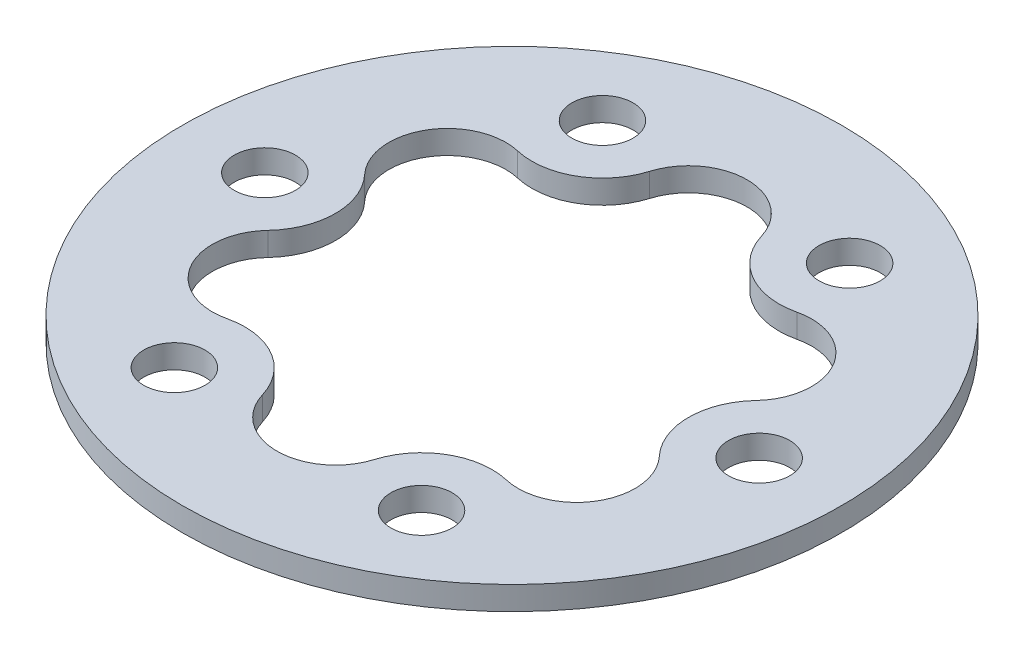
from build123d import *

# Parameters (mm, degrees)
SKETCH_1_R               = 28
SKETCH_1_R_2             = 2.6
EXTRUDE_1_DEPTH          = 2
CUT_EXTRUDE_2_DEPTH      = 40.648455203
CUT_EXTRUDE_2_DEPTH_BACK = 40.648455203


with BuildPart() as part:
    # 草图1 → 凸台-拉伸1 (new body)
    with BuildSketch(Plane(origin=(0, 0, 0), x_dir=(1, 0, 0), z_dir=(0, 1, 0))):
        with Locations(Location((0, 0, 0), (0, 0, 270))):
            Circle(SKETCH_1_R)
        with Locations(Location((10.5, 18.186533479, 0), (0, 0, 270))):
            Circle(SKETCH_1_R_2, mode=Mode.SUBTRACT)
        with Locations(Location((21, 0, 0), (0, 0, 270))):
            Circle(SKETCH_1_R_2, mode=Mode.SUBTRACT)
        with Locations(Location((10.5, -18.186533479, 0), (0, 0, 270))):
            Circle(SKETCH_1_R_2, mode=Mode.SUBTRACT)
        with Locations(Location((-10.5, -18.186533479, 0), (0, 0, 270))):
            Circle(SKETCH_1_R_2, mode=Mode.SUBTRACT)
        with Locations(Location((-21, 0, 0), (0, 0, 270))):
            Circle(SKETCH_1_R_2, mode=Mode.SUBTRACT)
        with Locations(Location((-10.5, 18.186533479, 0), (0, 0, 270))):
            Circle(SKETCH_1_R_2, mode=Mode.SUBTRACT)
    extrude(amount=EXTRUDE_1_DEPTH)

    # 草图4 → 切除-拉伸2 (cut, two sides: drawn at the far end of the back side and taken through both)
    with BuildSketch(Plane(origin=(0, 2, 0), x_dir=(1, 0, 0), z_dir=(0, 1, 0)).offset(-CUT_EXTRUDE_2_DEPTH_BACK)):
        with BuildLine():
            ThreePointArc((4.758569662, 16.444127766), (7.4999998, 12.990381172), (11.861747108, 12.343105991))
            ThreePointArc((11.861747108, 12.343105991), (17.29701741, 9.986437924), (16.620317219, 4.10102167))
            ThreePointArc((16.620317219, 4.10102167), (15, 2.31e-07), (16.620316904, -4.101021333))
            ThreePointArc((16.620316904, -4.101021333), (17.297017641, -9.986437525), (11.861747557, -12.343106096))
            ThreePointArc((11.861747557, -12.343106096), (7.5000002, -12.990380941), (4.758569796, -16.444127324))
            ThreePointArc((4.758569796, -16.444127324), (2.31e-07, -19.972875449), (-4.758569662, -16.444127766))
            ThreePointArc((-4.758569662, -16.444127766), (-7.4999998, -12.990381172), (-11.861747108, -12.343105991))
            ThreePointArc((-11.861747108, -12.343105991), (-17.29701741, -9.986437924), (-16.620317219, -4.10102167))
            ThreePointArc((-16.620317219, -4.10102167), (-15, -2.31e-07), (-16.620316904, 4.101021333))
            ThreePointArc((-16.620316904, 4.101021333), (-17.297017641, 9.986437525), (-11.861747557, 12.343106096))
            ThreePointArc((-11.861747557, 12.343106096), (-7.5000002, 12.990380941), (-4.758569796, 16.444127324))
            ThreePointArc((-4.758569796, 16.444127324), (-2.31e-07, 19.972875449), (4.758569662, 16.444127766))
        make_face()
    extrude(amount=CUT_EXTRUDE_2_DEPTH + CUT_EXTRUDE_2_DEPTH_BACK, mode=Mode.SUBTRACT)


solid = part.part
